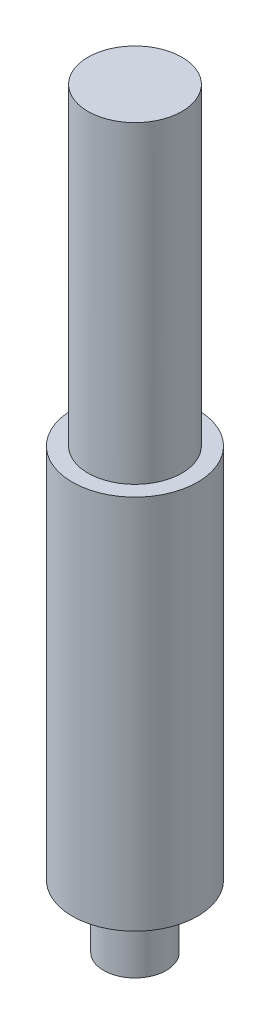
from build123d import *

# Parameters (mm, degrees)
SKETCH1_R           = 9.525
BOSS_EXTRUDE1_DEPTH = 63.5
SKETCH2_R           = 12.7
BOSS_EXTRUDE2_DEPTH = 76.2
SKETCH3_R           = 6.35
BOSS_EXTRUDE3_DEPTH = 12.7


with BuildPart() as part:
    # Sketch1 → Boss-Extrude1 (new body)
    with BuildSketch(Plane(origin=(0, 0, 0), x_dir=(1, 0, 0), z_dir=(0, 1, 0))):
        with Locations(Location((0, 0, 0), (0, 0, 270))):
            Circle(SKETCH1_R)
    extrude(amount=BOSS_EXTRUDE1_DEPTH)

    # Sketch2 → Boss-Extrude2 (add)
    with BuildSketch(Plane.XZ):
        with Locations(Location((0, 0, 0), (0, 0, 90))):
            Circle(SKETCH2_R)
    extrude(amount=BOSS_EXTRUDE2_DEPTH)

    # Sketch3 → Boss-Extrude3 (add)
    with BuildSketch(Plane.XZ.offset(76.2)):
        with Locations(Location((0, 0, 0), (0, 0, 270))):
            Circle(SKETCH3_R)
    extrude(amount=BOSS_EXTRUDE3_DEPTH)


solid = part.part
